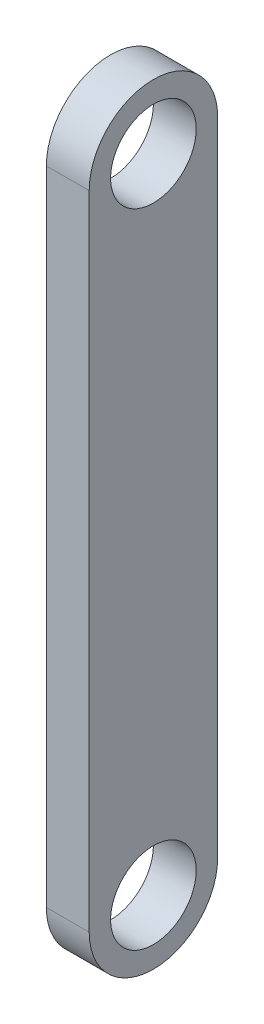
from build123d import *

# Parameters (mm, degrees)
SKETCH_1_R      = 2
EXTRUDE_1_DEPTH = 2


with BuildPart() as part:
    # ｽｹｯﾁ1 → ﾎﾞｽ - 押し出し1 (new body)
    with BuildSketch(Plane(origin=(0, 0, 0), x_dir=(0, 0, -1), z_dir=(1, 0, 0))):
        with BuildLine():
            Line((25.913974696, 10.802302357), (25.913974696, 40.802302357))
            ThreePointArc((25.913974696, 40.802302357), (22.913974696, 43.802302357), (19.913974696, 40.802302357))
            Line((19.913974696, 40.802302357), (19.913974696, 10.802302357))
            ThreePointArc((19.913974696, 10.802302357), (22.913974696, 7.802302357), (25.913974696, 10.802302357))
        make_face()
        with Locations((22.913974696, 40.802302357)):
            Circle(SKETCH_1_R, mode=Mode.SUBTRACT)
        with Locations((22.913974696, 10.802302357)):
            Circle(SKETCH_1_R, mode=Mode.SUBTRACT)
    extrude(amount=EXTRUDE_1_DEPTH)


solid = part.part
